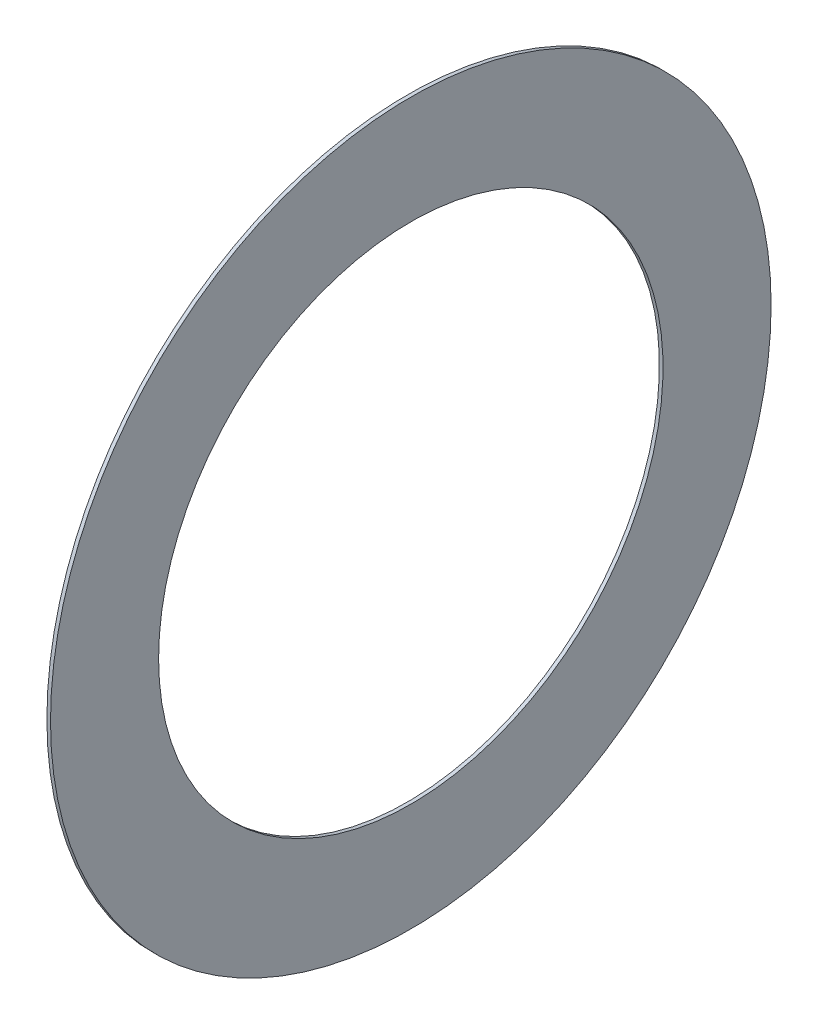
from build123d import *

# Parameters (mm, degrees)
SKETCH1_W = 0.1
SKETCH1_H = 3


with BuildPart() as part:
    # Sketch1 → Revolve1 (revolve)
    with BuildSketch(Plane.XY, mode=Mode.PRIVATE) as revolve1_sk:
        with Locations((0, 8.5)):
            Rectangle(SKETCH1_W, SKETCH1_H)
    revolve(revolve1_sk.sketch.rotate(Axis((-13.341176471, 0, 0), (1, 0, 0)), 90), axis=Axis((-13.341176471, 0, 0), (1, 0, 0)))


solid = part.part
